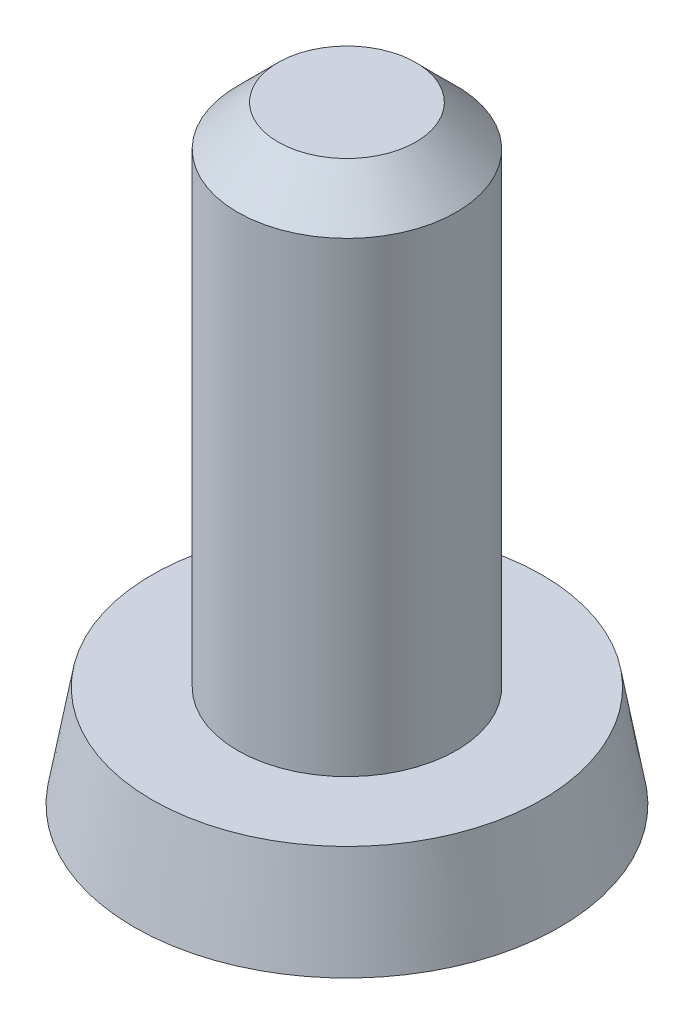
from build123d import *

# Parameters (mm, degrees)
SKETCH1_R           = 2.667
BOSS_EXTRUDE1_DEPTH = 1.27
BOSS_EXTRUDE1_TAPER = 10
SKETCH3_R           = 1.3716
BOSS_EXTRUDE2_DEPTH = 6.35
CHAMFER1_SIZE       = 0.508
CUT_EXTRUDE5_DEPTH  = 3.048
FILLET1_R           = 0.635


with BuildPart() as part:
    # Sketch1 → Boss-Extrude1 (new body)
    with BuildSketch(Plane(origin=(0, 0, 0), x_dir=(1, 0, 0), z_dir=(0, 1, 0))):
        Circle(SKETCH1_R)
    extrude(amount=BOSS_EXTRUDE1_DEPTH, taper=BOSS_EXTRUDE1_TAPER)

    # Sketch2 → Revolve1 (revolve)
    with BuildSketch(Plane(origin=(0, 0, 0), x_dir=(0, 0, -1), z_dir=(1, 0, 0))):
        with BuildLine():
            Line((0, 0), (0, -0.762))
            ThreePointArc((0, -0.762), (-1.387624328, -0.57043515), (-2.667, 0))
            Line((-2.667, 0), (0, 0))
        make_face()
    revolve(axis=Axis((0, 0, 0), (0, -1, 0)))

    # Sketch3 → Boss-Extrude2 (add)
    with BuildSketch(Plane(origin=(0, 1.27, 0), x_dir=(1, 0, 0), z_dir=(0, 1, 0))):
        with Locations(Location((0, 0, 0), (0, 0, 270))):
            Circle(SKETCH3_R)
    extrude(amount=BOSS_EXTRUDE2_DEPTH)

    # Chamfer1
    chamfer1_edges = [part.edges().sort_by_distance(p)[0] for p in [
        (0, 7.62, -1.3716),
    ]]
    chamfer(chamfer1_edges, length=CHAMFER1_SIZE)

    # Sketch4 → Cut-Extrude5 (cut)
    with BuildSketch(Plane(origin=(0, -2.54, 0), x_dir=(1, 0, 0), z_dir=(0, 1, 0))):
        Polygon((-1.651, 0.381), (-1.651, -0.381), (-0.381, -0.381), (-0.381, -1.651), (0.381, -1.651), (0.381, -0.381), (1.651, -0.381), (1.651, 0.381), (0.381, 0.381), (0.381, 1.651), (-0.381, 1.651), (-0.381, 0.381), align=None)
    extrude(amount=CUT_EXTRUDE5_DEPTH, mode=Mode.SUBTRACT)

    # Fillet1
    fillet1_edges = [part.edges().sort_by_distance(p)[0] for p in [
        (0.381, -0.113446581, -0.381),
        (-0.381, -0.113446581, -0.381),
        (0.381, -0.113446581, 0.381),
        (-0.381, -0.113446581, 0.381),
    ]]
    fillet(fillet1_edges, radius=FILLET1_R)


solid = part.part
